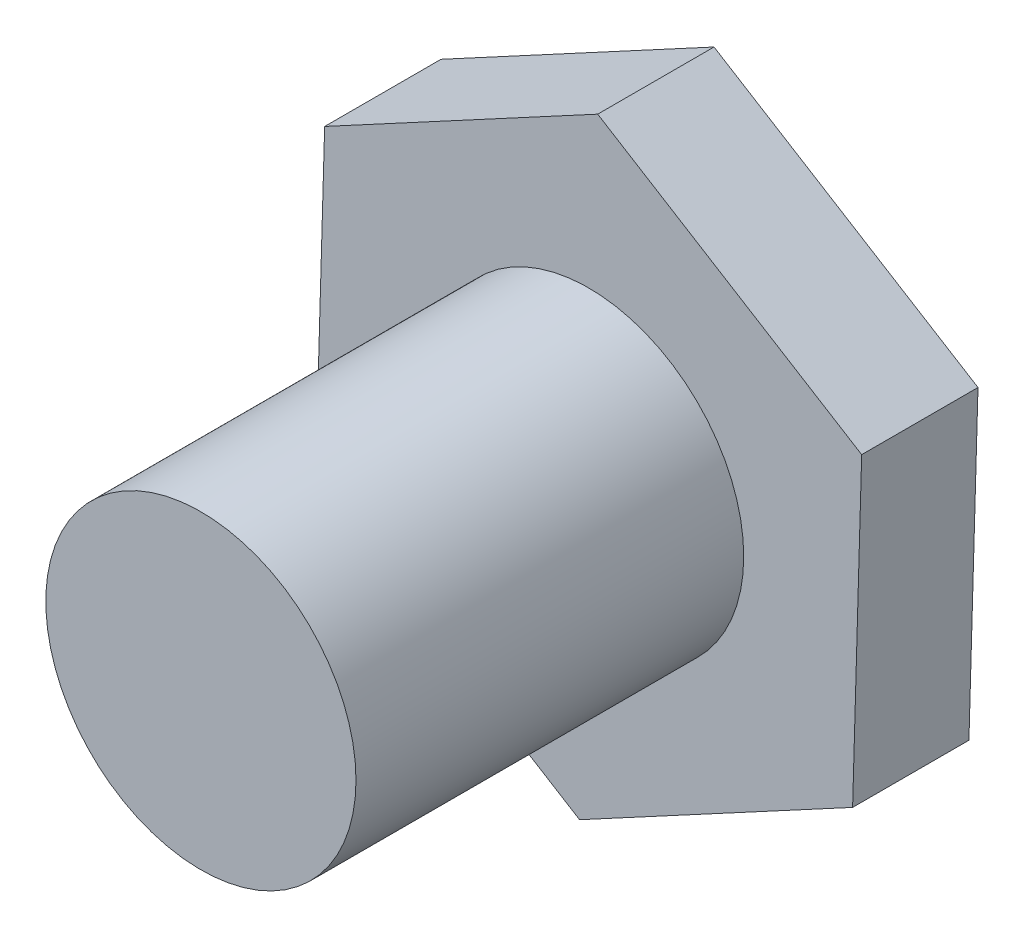
from build123d import *

# Parameters (mm, degrees)
EXTRUDE_1_DEPTH = 1.5
SKETCH_2_R      = 2
EXTRUDE_2_DEPTH = 5


with BuildPart() as part:
    # 草图1 → 凸台-拉伸1 (new body)
    with BuildSketch(Plane.XY):
        Polygon((3.404144051, -2.100429308), (3.521097165, 1.897860572), (0.116953114, 3.998289881), (-3.404144051, 2.100429308), (-3.521097165, -1.897860572), (-0.116953114, -3.998289881), align=None)
    extrude(amount=EXTRUDE_1_DEPTH)

    # 草图2 → 凸台-拉伸2 (add)
    with BuildSketch(Plane.XY.offset(1.5)):
        Circle(SKETCH_2_R)
    extrude(amount=EXTRUDE_2_DEPTH)


solid = part.part
